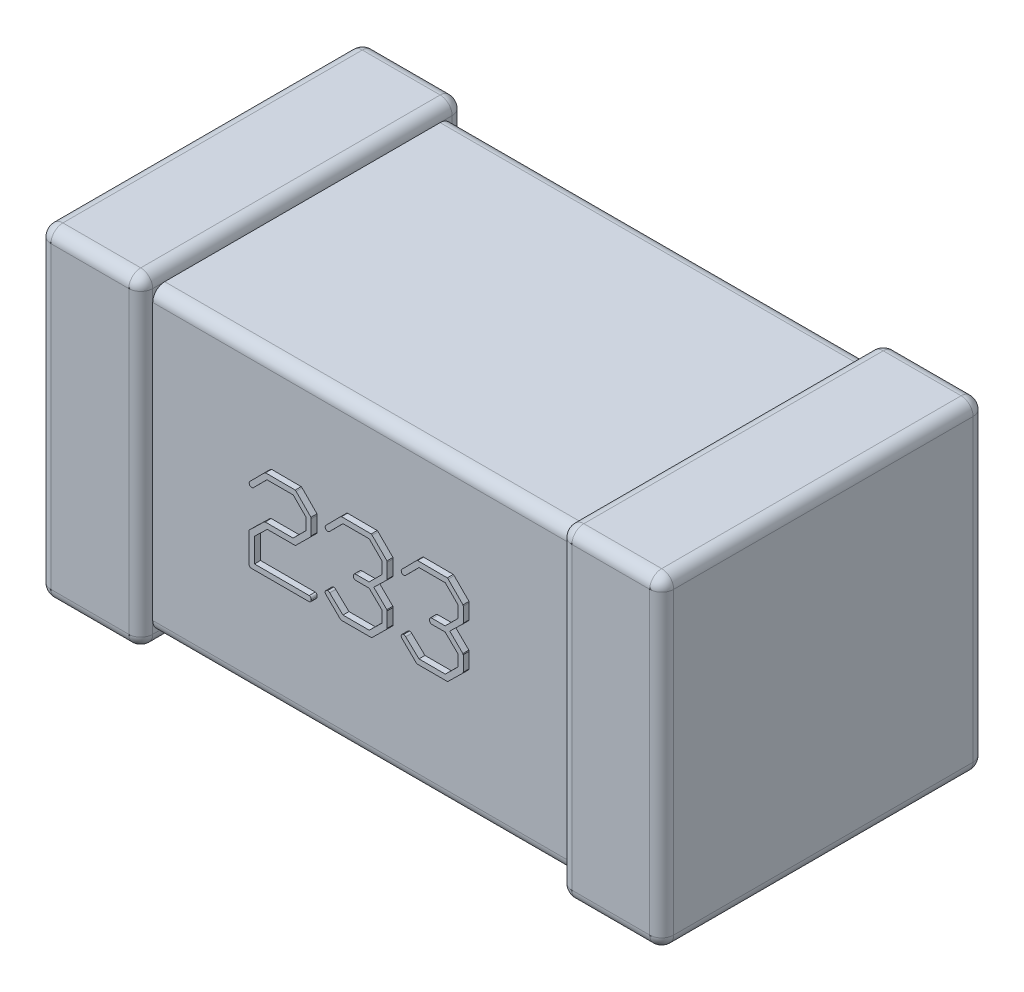
from build123d import *

# Parameters (mm, degrees)
SKETCH2_W                = 1
SKETCH2_H                = 0.5
BOSS_EXTRUDE1_DEPTH      = 0.5
FILLET3_R                = 0.02
BOSS_EXTRUDE3_DEPTH      = 0.02
BOSS_EXTRUDE3_DEPTH_BACK = 0.52
SKETCH3_W                = 0.17
SKETCH3_H                = 0.54
FILLET4_R                = 0.02
BOSS_EXTRUDE4_DEPTH      = 0.01
BOSS_EXTRUDE4_2_DEPTH    = 0.01
BOSS_EXTRUDE4_3_DEPTH    = 0.01


with BuildPart() as part:
    # Sketch2 → Boss-Extrude1 (new body)
    with BuildSketch(Plane(origin=(0, 0, 0), x_dir=(1, 0, 0), z_dir=(0, 1, 0))):
        with Locations((0.5, 0.25)):
            Rectangle(SKETCH2_W, SKETCH2_H)
    extrude(amount=BOSS_EXTRUDE1_DEPTH)

    # Fillet3
    fillet3_edges = [part.edges().sort_by_distance(p)[0] for p in [
        (1, 0.5, -0.25),
        (0.5, 0.5, 0),
        (0, 0.5, -0.25),
        (0.5, 0, 0),
        (1, 0, -0.25),
        (0.5, 0, -0.5),
        (0, 0, -0.25),
        (0, 0.25, 0),
        (1, 0.25, 0),
        (1, 0.25, -0.5),
        (0, 0.25, -0.5),
        (0.5, 0.5, -0.5),
    ]]
    fillet(fillet3_edges, radius=FILLET3_R)


with BuildPart() as body_2:
    # Sketch3 → Boss-Extrude3 (new, two sides: drawn at the far end of the back side and taken through both)
    with BuildSketch(Plane.XY.offset(-BOSS_EXTRUDE3_DEPTH_BACK)):
        with Locations((0.065, 0.25)):
            Rectangle(SKETCH3_W, SKETCH3_H)
    extrude(amount=BOSS_EXTRUDE3_DEPTH + BOSS_EXTRUDE3_DEPTH_BACK)

    # Fillet4
    fillet4_edges = [body_2.edges().sort_by_distance(p)[0] for p in [
        (-0.02, 0.25, 0.02),
        (0.15, 0.25, -0.52),
        (0.065, -0.02, 0.02),
        (0.15, 0.25, 0.02),
        (0.065, 0.52, 0.02),
        (0.065, 0.52, -0.52),
        (-0.02, 0.25, -0.52),
        (-0.02, 0.52, -0.25),
        (0.15, 0.52, -0.25),
        (0.15, -0.02, -0.25),
        (-0.02, -0.02, -0.25),
        (0.065, -0.02, -0.52),
    ]]
    fillet(fillet4_edges, radius=FILLET4_R)


with BuildPart() as body_3:
    # Body-Move/Copy1: copy of body 2
    add(body_2.part.moved(Location((0.87, 0, 0))))


with BuildPart() as body_4:
    # Sketch4 → Boss-Extrude4 (new body)
    with BuildSketch(Plane.XY):
        with BuildLine():
            Line((0.399439087, 0.336565272), (0.424243775, 0.311425763))
            Line((0.424243775, 0.311425763), (0.424662301, 0.309556343))
            Line((0.424662301, 0.309556343), (0.424662301, 0.284640048))
            Line((0.424662301, 0.284640048), (0.424243775, 0.283189155))
            Line((0.424243775, 0.283189155), (0.39885315, 0.258049647))
            Line((0.39885315, 0.258049647), (0.397011632, 0.257435807))
            Line((0.397011632, 0.257435807), (0.351336409, 0.257435807))
            Line((0.351336409, 0.257435807), (0.330019444, 0.236927995))
            Line((0.330019444, 0.236927995), (0.330019444, 0.196721522))
            Line((0.330019444, 0.196721522), (0.421397792, 0.196721522))
            add(Edge.make_bspline(
                [(0.421397792, 0.196721522), (0.421888097, 0.196611548), (0.422821182, 0.196402261), (0.423981763, 0.195437698), (0.424583336, 0.193958707), (0.424634441, 0.192857555), (0.424662301, 0.192257236)],
                knots=[0, 0, 0, 0, 0.972653314, 1.851030225, 2.828438158, 4, 4, 4, 4], degree=3))
            add(Edge.make_bspline(
                [(0.424662301, 0.192257236), (0.424632899, 0.191665735), (0.424577121, 0.190543651), (0.424034695, 0.189237989), (0.423301483, 0.188424544), (0.422456151, 0.188038901), (0.421379922, 0.187838563), (0.420580409, 0.187809099), (0.420142212, 0.18779295)],
                knots=[0, 0, 0, 0, 1.434830483, 2.721889557, 3.346325591, 4.054937858, 4.933952885, 6, 6, 6, 6], degree=3))
            Line((0.420142212, 0.18779295), (0.323769444, 0.18779295))
            add(Edge.make_bspline(
                [(0.323769444, 0.18779295), (0.323445712, 0.187938021), (0.322830678, 0.188213629), (0.322049992, 0.188823322), (0.321440854, 0.189552425), (0.321207164, 0.190128865), (0.321090873, 0.190415718)],
                knots=[0, 0, 0, 0, 1.095907464, 2.08203456, 3.045567458, 4, 4, 4, 4], degree=3))
            Line((0.321090873, 0.190415718), (0.321090873, 0.194461477))
            Line((0.321090873, 0.194461477), (0.321090873, 0.241308575))
            Line((0.321090873, 0.241308575), (0.346537301, 0.265973754))
            Line((0.346537301, 0.265973754), (0.347792882, 0.266364379))
            Line((0.347792882, 0.266364379), (0.394388864, 0.266364379))
            Line((0.394388864, 0.266364379), (0.41573373, 0.287597638))
            Line((0.41573373, 0.287597638), (0.41573373, 0.30763112))
            Line((0.41573373, 0.30763112), (0.394667882, 0.328864379))
            Line((0.394667882, 0.328864379), (0.350722569, 0.328864379))
            Line((0.350722569, 0.328864379), (0.327424578, 0.305426879))
            add(Edge.make_bspline(
                [(0.327424578, 0.305426879), (0.32705561, 0.305309061), (0.32639099, 0.305096838), (0.325696629, 0.305035595), (0.325387748, 0.305008352)],
                knots=[0, 0, 0, 0, 1.110314269, 2, 2, 2, 2], degree=3))
            add(Edge.make_bspline(
                [(0.325387748, 0.305008352), (0.324817831, 0.305056183), (0.32369671, 0.305150274), (0.322468399, 0.305923024), (0.321754387, 0.306787209), (0.321349387, 0.307594449), (0.321143104, 0.308551116), (0.321108783, 0.309229987), (0.321090873, 0.309584245)],
                knots=[0, 0, 0, 0, 1.43776488, 2.828318719, 3.533469534, 4.273415568, 5.099010321, 6, 6, 6, 6], degree=3))
            Line((0.321090873, 0.309584245), (0.3215094, 0.311453664))
            Line((0.3215094, 0.311453664), (0.346732614, 0.336955897))
            Line((0.346732614, 0.336955897), (0.348378819, 0.33779295))
            Line((0.348378819, 0.33779295), (0.397988194, 0.337597638))
            Line((0.397988194, 0.337597638), (0.399439087, 0.336565272))
        make_face()
    extrude(amount=BOSS_EXTRUDE4_DEPTH)


with BuildPart() as body_5:
    # Sketch4 → Boss-Extrude4 2 (new body)
    with BuildSketch(Plane.XY):
        with BuildLine():
            Line((0.526403373, 0.336565272), (0.55120806, 0.311732682))
            Line((0.55120806, 0.311732682), (0.551626587, 0.309919066))
            Line((0.551626587, 0.309919066), (0.551626587, 0.285281789))
            Line((0.551626587, 0.285281789), (0.550984846, 0.283858798))
            Line((0.550984846, 0.283858798), (0.529109846, 0.262681343))
            Line((0.529109846, 0.262681343), (0.550984846, 0.241113263))
            Line((0.550984846, 0.241113263), (0.551626587, 0.239690272))
            Line((0.551626587, 0.239690272), (0.551626587, 0.214467057))
            Line((0.551626587, 0.214467057), (0.551012748, 0.212820852))
            Line((0.551012748, 0.212820852), (0.52573373, 0.187988263))
            Line((0.52573373, 0.187988263), (0.523668998, 0.18779295))
            Line((0.523668998, 0.18779295), (0.474561855, 0.18779295))
            Line((0.474561855, 0.18779295), (0.473334176, 0.188602102))
            Line((0.473334176, 0.188602102), (0.448250471, 0.21309987))
            add(Edge.make_bspline(
                [(0.448250471, 0.21309987), (0.448197162, 0.213359524), (0.448063174, 0.214012147), (0.448058171, 0.214679224), (0.448055159, 0.215080897)],
                knots=[0, 0, 0, 0, 0.795724138, 2, 2, 2, 2], degree=3))
            add(Edge.make_bspline(
                [(0.448055159, 0.215080897), (0.448056936, 0.215371945), (0.448059839, 0.215847069), (0.448197239, 0.216300367), (0.448250471, 0.216475986)],
                knots=[0, 0, 0, 0, 1.225148227, 2, 2, 2, 2], degree=3))
            add(Edge.make_bspline(
                [(0.448250471, 0.216475986), (0.448442469, 0.21685484), (0.448814478, 0.217588893), (0.449745762, 0.218420181), (0.45085685, 0.219041151), (0.451711199, 0.219189043), (0.452156721, 0.219266164)],
                knots=[0, 0, 0, 0, 1.004527468, 1.946335261, 2.929065655, 4, 4, 4, 4], degree=3))
            add(Edge.make_bspline(
                [(0.452156721, 0.219266164), (0.452485124, 0.219255055), (0.45313872, 0.219232945), (0.454055865, 0.218904713), (0.454915337, 0.218419753), (0.455375872, 0.217949444), (0.455616542, 0.217703664)],
                knots=[0, 0, 0, 0, 1.001337907, 1.992890517, 2.951104048, 4, 4, 4, 4], degree=3))
            Line((0.455616542, 0.217703664), (0.477686855, 0.196721522))
            Line((0.477686855, 0.196721522), (0.521632167, 0.196721522))
            Line((0.521632167, 0.196721522), (0.542698016, 0.217424647))
            Line((0.542698016, 0.217424647), (0.542698016, 0.236732682))
            Line((0.542698016, 0.236732682), (0.52135315, 0.257435807))
            Line((0.52135315, 0.257435807), (0.49838998, 0.257435807))
            add(Edge.make_bspline(
                [(0.49838998, 0.257435807), (0.497884806, 0.257633597), (0.496933871, 0.258005915), (0.495858152, 0.259110726), (0.495172431, 0.260509076), (0.495123421, 0.261565878), (0.495097569, 0.262123307)],
                knots=[0, 0, 0, 0, 1.043123538, 1.963565367, 2.925846864, 4, 4, 4, 4], degree=3))
            add(Edge.make_bspline(
                [(0.495097569, 0.262123307), (0.495164119, 0.262750362), (0.495299445, 0.264025455), (0.496109081, 0.265021239), (0.49652056, 0.265527325)],
                knots=[0, 0, 0, 0, 0.98354347, 2, 2, 2, 2], degree=3))
            add(Edge.make_bspline(
                [(0.49652056, 0.265527325), (0.496721079, 0.265655922), (0.497154904, 0.265934144), (0.497951618, 0.266210209), (0.498925746, 0.266329093), (0.499626731, 0.266351942), (0.500008284, 0.266364379)],
                knots=[0, 0, 0, 0, 0.78205906, 1.691991385, 2.743730218, 4, 4, 4, 4], degree=3))
            Line((0.500008284, 0.266364379), (0.52135315, 0.266364379))
            Line((0.52135315, 0.266364379), (0.542698016, 0.287597638))
            Line((0.542698016, 0.287597638), (0.542698016, 0.30763112))
            Line((0.542698016, 0.30763112), (0.521632167, 0.328864379))
            Line((0.521632167, 0.328864379), (0.477686855, 0.328864379))
            Line((0.477686855, 0.328864379), (0.454388864, 0.305426879))
            add(Edge.make_bspline(
                [(0.454388864, 0.305426879), (0.454019895, 0.305309061), (0.453355276, 0.305096838), (0.452660915, 0.305035595), (0.452352034, 0.305008352)],
                knots=[0, 0, 0, 0, 1.110314269, 2, 2, 2, 2], degree=3))
            add(Edge.make_bspline(
                [(0.452352034, 0.305008352), (0.451782116, 0.305056183), (0.450660996, 0.305150274), (0.449432685, 0.305923024), (0.448718672, 0.306787209), (0.448313673, 0.307594449), (0.44810739, 0.308551116), (0.448073069, 0.309229987), (0.448055159, 0.309584245)],
                knots=[0, 0, 0, 0, 1.43776488, 2.828318719, 3.533469534, 4.273415568, 5.099010321, 6, 6, 6, 6], degree=3))
            Line((0.448055159, 0.309584245), (0.448473685, 0.311453664))
            Line((0.448473685, 0.311453664), (0.4736969, 0.336955897))
            Line((0.4736969, 0.336955897), (0.475343105, 0.33779295))
            Line((0.475343105, 0.33779295), (0.52495248, 0.337597638))
            Line((0.52495248, 0.337597638), (0.526403373, 0.336565272))
        make_face()
    extrude(amount=BOSS_EXTRUDE4_2_DEPTH)


with BuildPart() as body_6:
    # Sketch4 → Boss-Extrude4 3 (new body)
    with BuildSketch(Plane.XY):
        with BuildLine():
            Line((0.653367659, 0.336565272), (0.678172346, 0.311732682))
            Line((0.678172346, 0.311732682), (0.678590873, 0.309919066))
            Line((0.678590873, 0.309919066), (0.678590873, 0.285281789))
            Line((0.678590873, 0.285281789), (0.677949132, 0.283858798))
            Line((0.677949132, 0.283858798), (0.656074132, 0.262681343))
            Line((0.656074132, 0.262681343), (0.677949132, 0.241113263))
            Line((0.677949132, 0.241113263), (0.678590873, 0.239690272))
            Line((0.678590873, 0.239690272), (0.678590873, 0.214467057))
            Line((0.678590873, 0.214467057), (0.677977034, 0.212820852))
            Line((0.677977034, 0.212820852), (0.652698016, 0.187988263))
            Line((0.652698016, 0.187988263), (0.650633284, 0.18779295))
            Line((0.650633284, 0.18779295), (0.601526141, 0.18779295))
            Line((0.601526141, 0.18779295), (0.600298462, 0.188602102))
            Line((0.600298462, 0.188602102), (0.575214757, 0.21309987))
            add(Edge.make_bspline(
                [(0.575214757, 0.21309987), (0.575161448, 0.213359524), (0.57502746, 0.214012147), (0.575022457, 0.214679224), (0.575019444, 0.215080897)],
                knots=[0, 0, 0, 0, 0.795724138, 2, 2, 2, 2], degree=3))
            add(Edge.make_bspline(
                [(0.575019444, 0.215080897), (0.575021222, 0.215371945), (0.575024125, 0.215847069), (0.575161524, 0.216300367), (0.575214757, 0.216475986)],
                knots=[0, 0, 0, 0, 1.225148227, 2, 2, 2, 2], degree=3))
            add(Edge.make_bspline(
                [(0.575214757, 0.216475986), (0.575406755, 0.21685484), (0.575778764, 0.217588893), (0.576710048, 0.218420181), (0.577821136, 0.219041151), (0.578675485, 0.219189043), (0.579121007, 0.219266164)],
                knots=[0, 0, 0, 0, 1.004527468, 1.946335261, 2.929065655, 4, 4, 4, 4], degree=3))
            add(Edge.make_bspline(
                [(0.579121007, 0.219266164), (0.579449409, 0.219255055), (0.580103006, 0.219232945), (0.581020151, 0.218904713), (0.581879623, 0.218419753), (0.582340157, 0.217949444), (0.582580828, 0.217703664)],
                knots=[0, 0, 0, 0, 1.001337907, 1.992890517, 2.951104048, 4, 4, 4, 4], degree=3))
            Line((0.582580828, 0.217703664), (0.604651141, 0.196721522))
            Line((0.604651141, 0.196721522), (0.648596453, 0.196721522))
            Line((0.648596453, 0.196721522), (0.669662301, 0.217424647))
            Line((0.669662301, 0.217424647), (0.669662301, 0.236732682))
            Line((0.669662301, 0.236732682), (0.648317435, 0.257435807))
            Line((0.648317435, 0.257435807), (0.625354266, 0.257435807))
            add(Edge.make_bspline(
                [(0.625354266, 0.257435807), (0.624849091, 0.257633597), (0.623898156, 0.258005915), (0.622822438, 0.259110726), (0.622136717, 0.260509076), (0.622087706, 0.261565878), (0.622061855, 0.262123307)],
                knots=[0, 0, 0, 0, 1.043123538, 1.963565367, 2.925846864, 4, 4, 4, 4], degree=3))
            add(Edge.make_bspline(
                [(0.622061855, 0.262123307), (0.622128404, 0.262750362), (0.62226373, 0.264025455), (0.623073366, 0.265021239), (0.623484846, 0.265527325)],
                knots=[0, 0, 0, 0, 0.98354347, 2, 2, 2, 2], degree=3))
            add(Edge.make_bspline(
                [(0.623484846, 0.265527325), (0.623685365, 0.265655922), (0.62411919, 0.265934144), (0.624915903, 0.266210209), (0.625890032, 0.266329093), (0.626591017, 0.266351942), (0.626972569, 0.266364379)],
                knots=[0, 0, 0, 0, 0.78205906, 1.691991385, 2.743730218, 4, 4, 4, 4], degree=3))
            Line((0.626972569, 0.266364379), (0.648317435, 0.266364379))
            Line((0.648317435, 0.266364379), (0.669662301, 0.287597638))
            Line((0.669662301, 0.287597638), (0.669662301, 0.30763112))
            Line((0.669662301, 0.30763112), (0.648596453, 0.328864379))
            Line((0.648596453, 0.328864379), (0.604651141, 0.328864379))
            Line((0.604651141, 0.328864379), (0.58135315, 0.305426879))
            add(Edge.make_bspline(
                [(0.58135315, 0.305426879), (0.580984181, 0.305309061), (0.580319561, 0.305096838), (0.579625201, 0.305035595), (0.579316319, 0.305008352)],
                knots=[0, 0, 0, 0, 1.110314269, 2, 2, 2, 2], degree=3))
            add(Edge.make_bspline(
                [(0.579316319, 0.305008352), (0.578746402, 0.305056183), (0.577625281, 0.305150274), (0.576396971, 0.305923024), (0.575682958, 0.306787209), (0.575277959, 0.307594449), (0.575071676, 0.308551116), (0.575037354, 0.309229987), (0.575019444, 0.309584245)],
                knots=[0, 0, 0, 0, 1.43776488, 2.828318719, 3.533469534, 4.273415568, 5.099010321, 6, 6, 6, 6], degree=3))
            Line((0.575019444, 0.309584245), (0.575437971, 0.311453664))
            Line((0.575437971, 0.311453664), (0.600661185, 0.336955897))
            Line((0.600661185, 0.336955897), (0.602307391, 0.33779295))
            Line((0.602307391, 0.33779295), (0.651916766, 0.337597638))
            Line((0.651916766, 0.337597638), (0.653367659, 0.336565272))
        make_face()
    extrude(amount=BOSS_EXTRUDE4_3_DEPTH)


solid = Compound([part.part, body_2.part, body_3.part, body_4.part, body_5.part, body_6.part])
